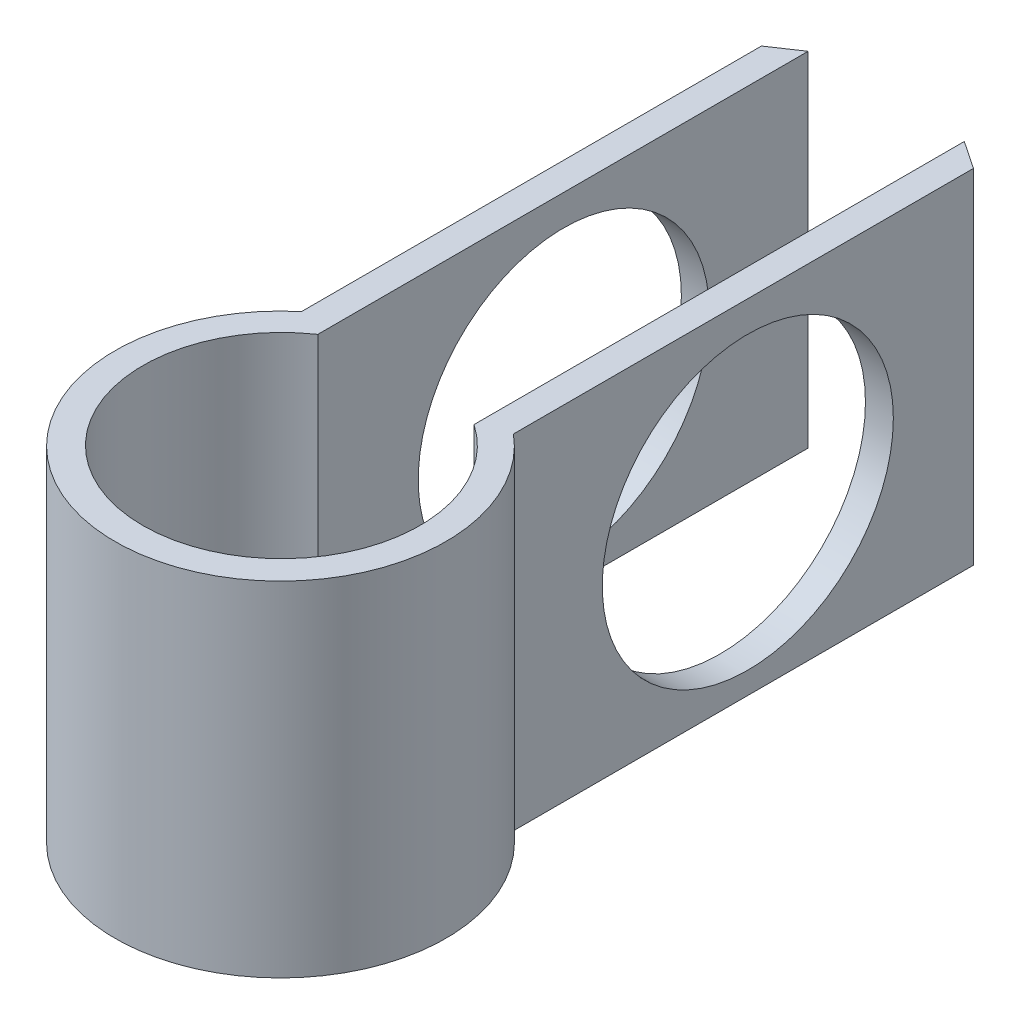
from build123d import *

# Parameters (mm, degrees)
BOSS_EXTRUDE1_DEPTH = 31.57982
SKETCH2_R           = 13.372801857
CUT_EXTRUDE1_DEPTH  = 117.170888451


with BuildPart() as part:
    # Sketch1 → Boss-Extrude1 (new body)
    with BuildSketch(Plane(origin=(0, 0, 0), x_dir=(1, 0, 0), z_dir=(0, 1, 0))):
        with BuildLine():
            Line((136.250172, 107.259882), (136.250172, 64.988694))
            ThreePointArc((136.250172, 64.988694), (126.511558, 38.118796), (116.772944, 64.988694))
            Line((116.772944, 64.988694), (116.772944, 107.259882))
            Line((116.772944, 107.259882), (119.334788, 108.979208))
            Line((119.334788, 108.979208), (119.334788, 63.925704))
            ThreePointArc((119.334788, 63.925704), (126.511558, 40.670734), (133.688328, 63.925704))
            Line((133.688328, 63.925704), (133.688328, 108.979208))
            Line((133.688328, 108.979208), (136.250172, 107.259882))
        make_face()
    extrude(amount=-BOSS_EXTRUDE1_DEPTH)

    # Sketch2 → Cut-Extrude1 (cut, through all)
    with BuildSketch(Plane(origin=(136.250172, 0, 0), x_dir=(0, 0, -1), z_dir=(1, 0, 0))):
        with Locations((86.524338, -16.195802)):
            Circle(SKETCH2_R)
    extrude(amount=-CUT_EXTRUDE1_DEPTH, mode=Mode.SUBTRACT)


solid = part.part
